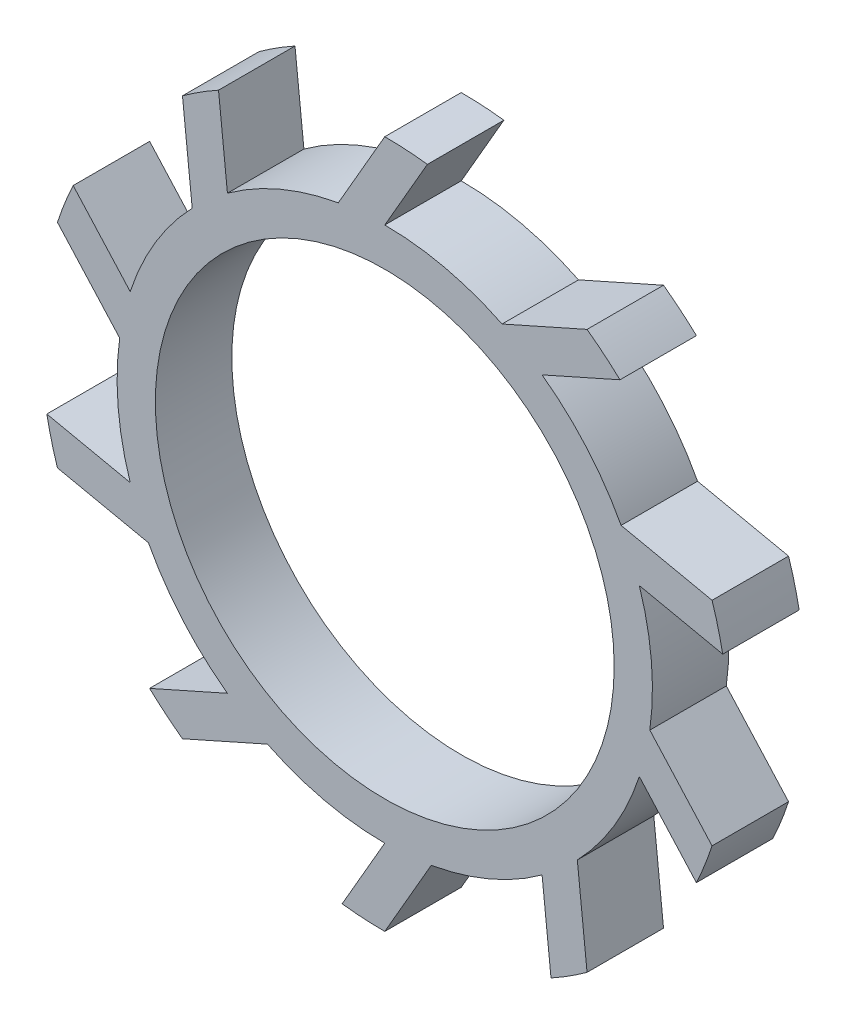
from build123d import *

# Parameters (mm, degrees)
SKETCH1_R           = 15
BOSS_EXTRUDE1_DEPTH = 2.5
SCALE1_SCALE        = 1.5


with BuildPart() as part:
    # Sketch1 → Boss-Extrude1 (new, symmetric)
    with BuildSketch(Plane.XY):
        with BuildLine():
            Line((0, 22.5), (-3.040407483, 17.233859763))
            ThreePointArc((-3.040407483, 17.233859763), (-6.838525862, 16.108524577), (-10.286241915, 14.157797402))
            Line((-10.286241915, 14.157797402), (-10.868827163, 19.700725776))
            ThreePointArc((-10.868827163, 19.700725776), (-12.070254205, 18.988390227), (-13.225168177, 18.202882373))
            Line((-13.225168177, 18.202882373), (-12.589549933, 12.155378747))
            ThreePointArc((-12.589549933, 12.155378747), (-15.000836821, 9.012485488), (-16.643489035, 5.407797402))
            Line((-16.643489035, 5.407797402), (-20.372861954, 9.549685638))
            ThreePointArc((-20.372861954, 9.549685638), (-20.926136519, 8.267212977), (-21.398771617, 6.952882373))
            Line((-21.398771617, 6.952882373), (-17.329912211, 2.433956196))
            ThreePointArc((-17.329912211, 2.433956196), (-17.433337974, -1.526016734), (-16.643489035, -5.407797402))
            Line((-16.643489035, -5.407797402), (-22.095155927, -4.249009832))
            ThreePointArc((-22.095155927, -4.249009832), (-21.788945935, -5.611758639), (-21.398771617, -6.952882373))
            Line((-21.398771617, -6.952882373), (-15.450837046, -8.217154895))
            ThreePointArc((-15.450837046, -8.217154895), (-13.206896559, -11.481632431), (-10.286241915, -14.157797402))
            Line((-10.286241915, -14.157797402), (-15.377851323, -16.424727964))
            ThreePointArc((-15.377851323, -16.424727964), (-14.329118584, -17.347229191), (-13.225168177, -18.202882373))
            Line((-13.225168177, -18.202882373), (-7.670067285, -15.729592107))
            ThreePointArc((-7.670067285, -15.729592107), (-3.935869544, -17.051654786), (0, -17.5))
            Line((0, -17.5), (-2.786730187, -22.32675827))
            ThreePointArc((-2.786730187, -22.32675827), (-1.396054962, -22.456647803), (0, -22.5))
            Line((0, -22.5), (3.040407483, -17.233859763))
            ThreePointArc((3.040407483, -17.233859763), (6.838525862, -16.108524577), (10.286241915, -14.157797402))
            Line((10.286241915, -14.157797402), (10.868827163, -19.700725776))
            ThreePointArc((10.868827163, -19.700725776), (12.070254205, -18.988390227), (13.225168177, -18.202882373))
            Line((13.225168177, -18.202882373), (12.589549933, -12.155378747))
            ThreePointArc((12.589549933, -12.155378747), (15.000836821, -9.012485488), (16.643489035, -5.407797402))
            Line((16.643489035, -5.407797402), (20.372861954, -9.549685638))
            ThreePointArc((20.372861954, -9.549685638), (20.926136519, -8.267212977), (21.398771617, -6.952882373))
            Line((21.398771617, -6.952882373), (17.329912211, -2.433956196))
            ThreePointArc((17.329912211, -2.433956196), (17.433337974, 1.526016734), (16.643489035, 5.407797402))
            Line((16.643489035, 5.407797402), (22.095155927, 4.249009832))
            ThreePointArc((22.095155927, 4.249009832), (21.788945935, 5.611758639), (21.398771617, 6.952882373))
            Line((21.398771617, 6.952882373), (15.450837046, 8.217154895))
            ThreePointArc((15.450837046, 8.217154895), (13.206896559, 11.481632431), (10.286241915, 14.157797402))
            Line((10.286241915, 14.157797402), (15.377851323, 16.424727964))
            ThreePointArc((15.377851323, 16.424727964), (14.329118584, 17.347229191), (13.225168177, 18.202882373))
            Line((13.225168177, 18.202882373), (7.670067285, 15.729592107))
            ThreePointArc((7.670067285, 15.729592107), (3.935869544, 17.051654786), (0, 17.5))
            Line((0, 17.5), (2.786730187, 22.32675827))
            ThreePointArc((2.786730187, 22.32675827), (1.396054962, 22.456647803), (0, 22.5))
        make_face()
        Circle(SKETCH1_R, mode=Mode.SUBTRACT)
    extrude(amount=BOSS_EXTRUDE1_DEPTH, both=True)


with BuildPart() as part_1:
    # Scale1: scaled about (0, 0, 0)
    add(part.part.scale(SCALE1_SCALE))


solid = part_1.part
